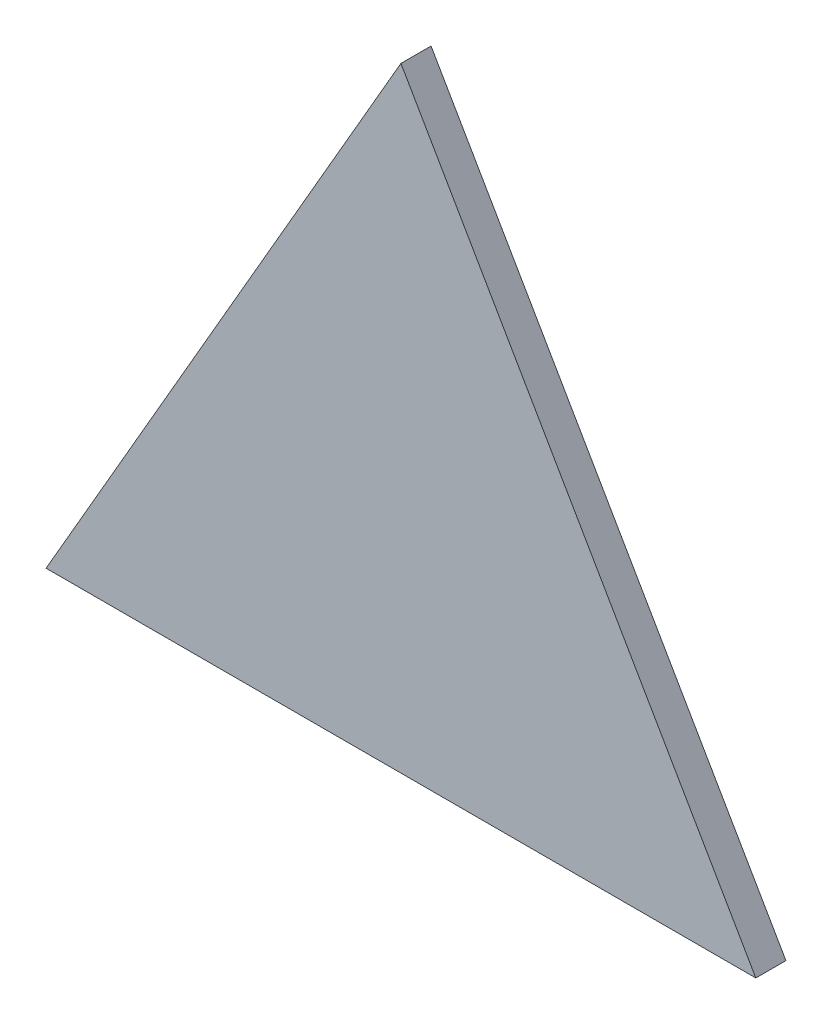
from build123d import *

# Parameters (mm, degrees)
EXTRUDE_1_DEPTH = 1


with BuildPart() as part:
    # 草图1 → 凸台-拉伸1 (new body)
    with BuildSketch(Plane.XY):
        Polygon((-11.785, 0), (11.785, 0), (0, 20.412218767), align=None)
    extrude(amount=EXTRUDE_1_DEPTH)


solid = part.part
